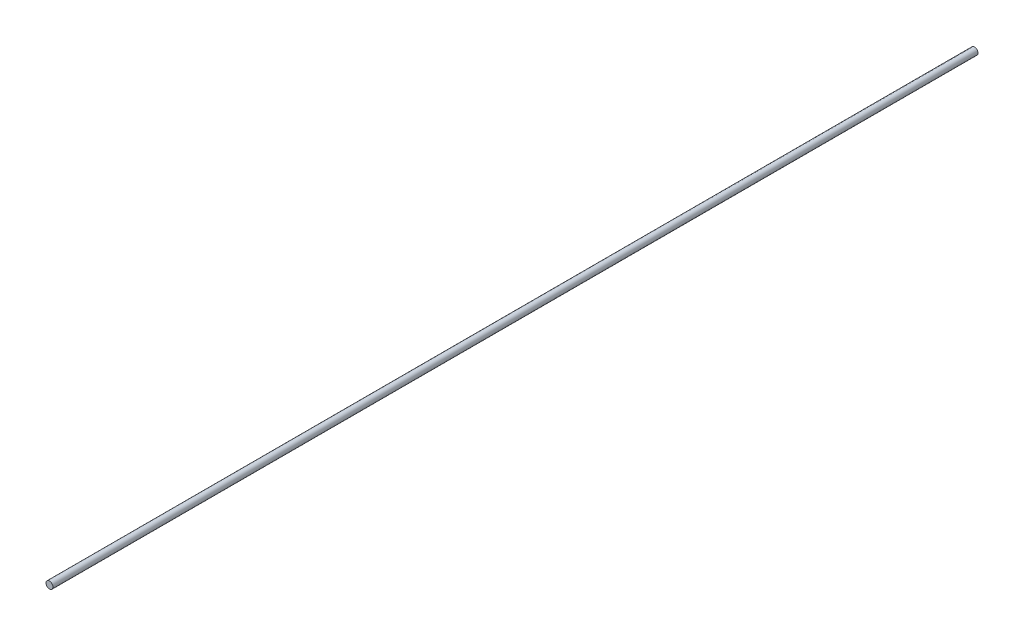
from build123d import *

# Parameters (mm, degrees)
SKETCH_1_R      = 1.5
EXTRUDE_1_DEPTH = 400


with BuildPart() as part:
    # 草图1 → 凸台-拉伸1 (new body)
    with BuildSketch(Plane.XY):
        Circle(SKETCH_1_R)
    extrude(amount=-EXTRUDE_1_DEPTH)


solid = part.part
